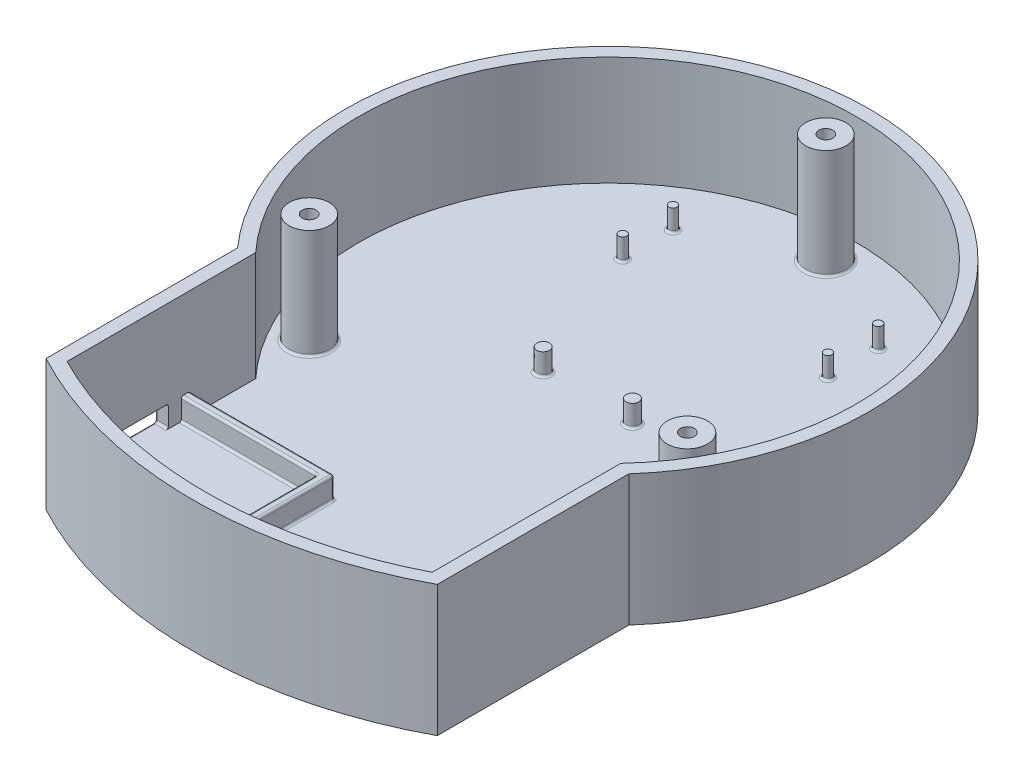
from build123d import *

# Parameters (mm, degrees)
CROQUIS1_R              = 60
CROQUIS1_R_2            = 1.6
SALIENTE_EXTRUIR1_DEPTH = 5
SALIENTE_EXTRUIR2_START = -5
SALIENTE_EXTRUIR2_DEPTH = 5
SALIENTE_EXTRUIR3_DEPTH = 25
CROQUIS4_R              = 1.45
SALIENTE_EXTRUIR4_DEPTH = 5
CROQUIS5_R              = 0.925
SALIENTE_EXTRUIR5_DEPTH = 5
CROQUIS6_R              = 4.6
CROQUIS6_R_2            = 1.6
SALIENTE_EXTRUIR6_DEPTH = 25
REDONDEO1_R             = 0.5
CROQUIS7_W              = 15
CROQUIS7_H              = 5
CORTAR_EXTRUIR1_DEPTH   = 5
REDONDEO2_R             = 0.5
SALIENTE_EXTRUIR7_DEPTH = 5
REDONDEO3_R             = 0.5


with BuildPart() as part:
    # Croquis1 → Saliente-Extruir1 (new body)
    with BuildSketch(Plane(origin=(0, 0, 0), x_dir=(1, 0, 0), z_dir=(0, 1, 0))):
        with Locations(Location((0, 0, 0), (0, 0, 270))):
            Circle(CROQUIS1_R)
        with Locations(Location((0, 50, 0), (0, 0, 270))):
            Circle(CROQUIS1_R_2, mode=Mode.SUBTRACT)
        with Locations(Location((43.301270189, -25, 0), (0, 0, 270))):
            Circle(CROQUIS1_R_2, mode=Mode.SUBTRACT)
        with Locations(Location((-43.301270189, -25, 0), (0, 0, 270))):
            Circle(CROQUIS1_R_2, mode=Mode.SUBTRACT)
    extrude(amount=SALIENTE_EXTRUIR1_DEPTH)

    # Croquis2 → Saliente-Extruir2 (add)
    with BuildSketch(Plane(origin=(0, 5, 0), x_dir=(1, 0, 0), z_dir=(0, 1, 0)).offset(SALIENTE_EXTRUIR2_START)):
        with BuildLine():
            Line((-44.801270189, -39.910477189), (-44.801270189, -83.772586145))
            ThreePointArc((-44.801270189, -83.772586145), (0, -95), (44.801270189, -83.772586145))
            Line((44.801270189, -83.772586145), (44.801270189, -39.910477189))
            ThreePointArc((44.801270189, -39.910477189), (0, -60), (-44.801270189, -39.910477189))
        make_face()
    extrude(amount=SALIENTE_EXTRUIR2_DEPTH)

    # Croquis3 → Saliente-Extruir3 (add)
    with BuildSketch(Plane(origin=(0, 5, 0), x_dir=(1, 0, 0), z_dir=(0, 1, 0))):
        with BuildLine():
            Line((-44.801270189, -39.910477189), (-44.801270189, -83.772586145))
            ThreePointArc((-44.801270189, -83.772586145), (0, -95), (44.801270189, -83.772586145))
            Line((44.801270189, -83.772586145), (44.801270189, -39.910477189))
            ThreePointArc((44.801270189, -39.910477189), (0, 60), (-44.801270189, -39.910477189))
        make_face()
        with BuildLine():
            Line((-41.801270189, -38.751178183), (-41.801270189, -81.955193921))
            ThreePointArc((-41.801270189, -81.955193921), (0, -92), (41.801270189, -81.955193921))
            Line((41.801270189, -81.955193921), (41.801270189, -38.751178183))
            ThreePointArc((41.801270189, -38.751178183), (0, 57), (-41.801270189, -38.751178183))
        make_face(mode=Mode.SUBTRACT)
    extrude(amount=SALIENTE_EXTRUIR3_DEPTH)

    # Croquis4 → Saliente-Extruir4 (add)
    with BuildSketch(Plane(origin=(0, 5, 0), x_dir=(1, 0, 0), z_dir=(0, 1, 0))):
        with Locations(Location((-10.225, -4.5, 0), (0, 0, 270))):
            Circle(CROQUIS4_R)
        with Locations(Location((10.225, -4.5, 0), (0, 0, 90))):
            Circle(CROQUIS4_R)
    extrude(amount=SALIENTE_EXTRUIR4_DEPTH)

    # Croquis5 → Saliente-Extruir5 (add)
    with BuildSketch(Plane(origin=(0, 5, 0), x_dir=(1, 0, 0), z_dir=(0, 1, 0))):
        with Locations(Location((23.5, 38.5, 0), (0, 0, 270))):
            Circle(CROQUIS5_R)
        with Locations(Location((23.5, 27, 0), (0, 0, 270))):
            Circle(CROQUIS5_R)
        with Locations(Location((-23.5, 27, 0), (0, 0, 270))):
            Circle(CROQUIS5_R)
        with Locations(Location((-23.5, 38.5, 0), (0, 0, 270))):
            Circle(CROQUIS5_R)
    extrude(amount=SALIENTE_EXTRUIR5_DEPTH)

    # Croquis6 → Saliente-Extruir6 (add)
    # profile 1 of 3: a face of its own
    with BuildSketch(Plane(origin=(0, 5, 0), x_dir=(1, 0, 0), z_dir=(0, 1, 0))):
        with Locations(Location((0, 50, 0), (0, 0, 270))):
            Circle(CROQUIS6_R)
        with Locations(Location((0, 50, 0), (0, 0, 270))):
            Circle(CROQUIS6_R_2, mode=Mode.SUBTRACT)
    # profile 2 of 3: a face of its own
    with BuildSketch(Plane(origin=(0, 5, 0), x_dir=(1, 0, 0), z_dir=(0, 1, 0))):
        with Locations(Location((43.301270189, -25, 0), (0, 0, 270))):
            Circle(CROQUIS6_R)
        with Locations(Location((43.301270189, -25, 0), (0, 0, 270))):
            Circle(CROQUIS6_R_2, mode=Mode.SUBTRACT)
    # profile 3 of 3: a face of its own
    with BuildSketch(Plane(origin=(0, 5, 0), x_dir=(1, 0, 0), z_dir=(0, 1, 0))):
        with Locations(Location((-43.301270189, -25, 0), (0, 0, 270))):
            Circle(CROQUIS6_R)
        with Locations(Location((-43.301270189, -25, 0), (0, 0, 270))):
            Circle(CROQUIS6_R_2, mode=Mode.SUBTRACT)
    extrude(amount=SALIENTE_EXTRUIR6_DEPTH)

    # Redondeo1
    redondeo1_edges = [part.edges().sort_by_distance(p)[0] for p in [
        (-10.225, 5, 3.05),
        (10.225, 5, 5.95),
        (-23.5, 5, -39.425),
        (-23.5, 5, -27.925),
        (23.5, 5, -27.925),
        (23.5, 5, -39.425),
        (0, 5, -54.6),
        (43.301270189, 5, 20.4),
        (-43.301270189, 5, 20.4),
    ]]
    fillet(redondeo1_edges, radius=REDONDEO1_R)

    # Croquis7 → Cortar-Extruir1 (cut)
    with BuildSketch(Plane.ZY.offset(44.801270189)):
        with Locations((66.272586145, 7.5)):
            Rectangle(CROQUIS7_W, CROQUIS7_H)
    extrude(amount=-CORTAR_EXTRUIR1_DEPTH, mode=Mode.SUBTRACT)

    # Redondeo2
    redondeo2_edges = [part.edges().sort_by_distance(p)[0] for p in [
        (-43.301270189, 5, 73.772586145),
        (-43.301270189, 5, 58.772586145),
        (-43.301270189, 10, 58.772586145),
        (-43.301270189, 10, 73.772586145),
        (-44.801270189, 7.5, 58.772586145),
        (-44.801270189, 5, 66.272586145),
        (-44.801270189, 7.5, 73.772586145),
        (-44.801270189, 10, 66.272586145),
    ]]
    fillet(redondeo2_edges, radius=REDONDEO2_R)

    # Croquis9 → Saliente-Extruir7 (add)
    with BuildSketch(Plane(origin=(0, 5, 0), x_dir=(1, 0, 0), z_dir=(0, 1, 0))):
        Polygon((-41.801270189, -55.772586145), (-10.801270189, -55.772586145), (-10.801270189, -76.772586145), (-41.801270189, -76.772586145), (-41.801270189, -78.772586145), (-8.801270189, -78.772586145), (-8.801270189, -53.772586145), (-41.801270189, -53.772586145), align=None)
    extrude(amount=SALIENTE_EXTRUIR7_DEPTH)

    # Redondeo3
    redondeo3_edges = [part.edges().sort_by_distance(p)[0] for p in [
        (-26.301270189, 5, 55.772586145),
        (-10.801270189, 5, 66.272586145),
        (-10.801270189, 7.5, 55.772586145),
        (-26.301270189, 5, 76.772586145),
        (-10.801270189, 7.5, 76.772586145),
        (-25.301270189, 5, 78.772586145),
        (-8.801270189, 5, 66.272586145),
        (-8.801270189, 7.5, 78.772586145),
        (-25.301270189, 5, 53.772586145),
        (-8.801270189, 7.5, 53.772586145),
        (-26.301270189, 10, 55.772586145),
        (-10.801270189, 10, 66.272586145),
        (-26.301270189, 10, 76.772586145),
        (-25.301270189, 10, 78.772586145),
        (-8.801270189, 10, 66.272586145),
        (-25.301270189, 10, 53.772586145),
    ]]
    fillet(redondeo3_edges, radius=REDONDEO3_R)


solid = part.part
